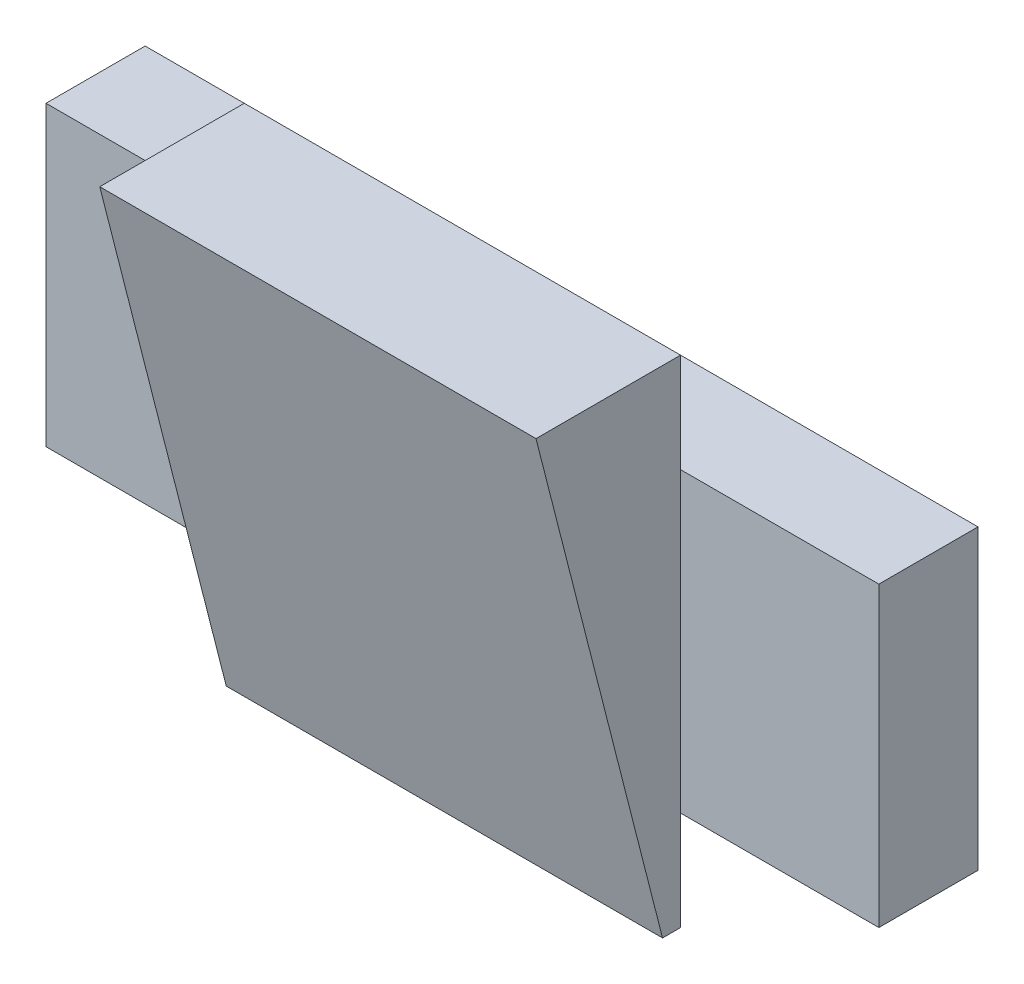
from build123d import *

# Parameters (mm, degrees)
SKETCH_1_W          = 42
SKETCH_1_H          = 15
EXTRUDE_1_DEPTH     = 5
SKETCH_2_W          = 22
SKETCH_2_H          = 25
EXTRUDE_2_DEPTH     = 9.5
CUT_EXTRUDE_1_DEPTH = 37


with BuildPart() as part:
    # 스케치1 → 보스-돌출1 (new body)
    with BuildSketch(Plane.XY):
        Rectangle(SKETCH_1_W, SKETCH_1_H)
    extrude(amount=EXTRUDE_1_DEPTH)

    # 스케치2 → 보스-돌출2 (add)
    with BuildSketch(Plane.XY.offset(5)):
        Rectangle(SKETCH_2_W, SKETCH_2_H)
    extrude(amount=EXTRUDE_2_DEPTH)

    # 스케치3 → 컷-돌출1 (cut)
    with BuildSketch(Plane(origin=(11, 0, 0), x_dir=(0, 0, -1), z_dir=(1, 0, 0))):
        Polygon((-12.28944968, 12.5), (-5.909253868, -12.5), (-14.5, -12.5), (-14.5, 12.5), align=None)
    extrude(amount=-CUT_EXTRUDE_1_DEPTH, mode=Mode.SUBTRACT)


solid = part.part
